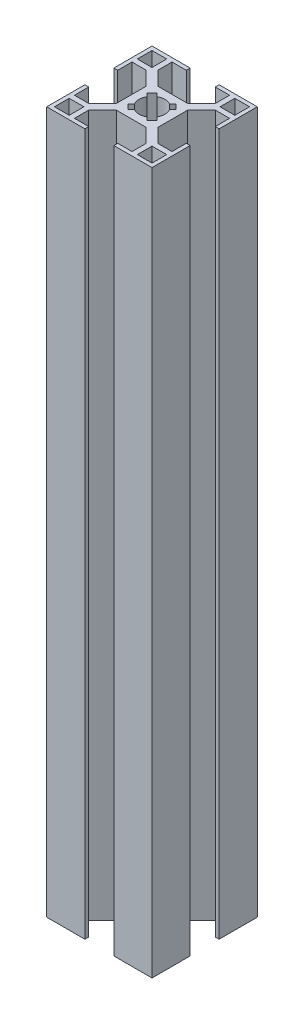
from build123d import *

# Parameters (mm, degrees)
CROQUIS2_W              = 4.2
CROQUIS2_H              = 4.2
SALIENTE_EXTRUIR1_DEPTH = 200


with BuildPart() as part:
    # Croquis2 → Saliente-Extruir1 (new body)
    with BuildSketch(Plane(origin=(0, 0, 0), x_dir=(1, 0, 0), z_dir=(0, 1, 0))):
        Polygon((-37.373217156, 24.271112291), (-26.498217156, 24.271112291), (-26.498217156, 23.171112291), (-30.573217156, 23.171112291), (-30.573217156, 19.168168566), (-26.586160881, 15.181112291), (-18.160273431, 15.181112291), (-14.173217156, 19.168168566), (-14.173217156, 23.171112291), (-18.248217156, 23.171112291), (-18.248217156, 24.271112291), (-7.373217156, 24.271112291), (-7.373217156, 13.396112291), (-8.473217156, 13.396112291), (-8.473217156, 17.471112291), (-12.476160881, 17.471112291), (-16.463217156, 13.484056016), (-16.463217156, 5.058168566), (-12.476160881, 1.071112291), (-8.473217156, 1.071112291), (-8.473217156, 5.146112291), (-7.373217156, 5.146112291), (-7.373217156, -5.728887709), (-18.248217156, -5.728887709), (-18.248217156, -4.628887709), (-14.173217156, -4.628887709), (-14.173217156, -0.625943984), (-18.160273431, 3.361112291), (-26.586160881, 3.361112291), (-30.573217156, -0.625943984), (-30.573217156, -4.628887709), (-26.498217156, -4.628887709), (-26.498217156, -5.728887709), (-37.373217156, -5.728887709), (-37.373217156, 5.146112291), (-36.273217156, 5.146112291), (-36.273217156, 1.071112291), (-32.270273431, 1.071112291), (-28.283217156, 5.058168566), (-28.283217156, 13.484056016), (-32.270273431, 17.471112291), (-36.273217156, 17.471112291), (-36.273217156, 13.396112291), (-37.373217156, 13.396112291), align=None)
        with Locations((-10.573217156, 21.071112291)):
            Rectangle(CROQUIS2_W, CROQUIS2_H, mode=Mode.SUBTRACT)
        with Locations((-34.173217156, -2.528887709)):
            Rectangle(CROQUIS2_W, CROQUIS2_H, mode=Mode.SUBTRACT)
        with Locations((-34.173217156, 21.071112291)):
            Rectangle(CROQUIS2_W, CROQUIS2_H, mode=Mode.SUBTRACT)
        with Locations((-10.573217156, -2.528887709)):
            Rectangle(CROQUIS2_W, CROQUIS2_H, mode=Mode.SUBTRACT)
        with BuildLine():
            Line((-19.165547938, 11.064567946), (-18.248217156, 11.981898728))
            Line((-18.248217156, 11.981898728), (-19.662430718, 13.396112291))
            Line((-19.662430718, 13.396112291), (-20.5797615, 12.478781509))
            ThreePointArc((-20.5797615, 12.478781509), (-22.373217156, 12.946112291), (-24.166672811, 12.478781509))
            Line((-24.166672811, 12.478781509), (-25.084003593, 13.396112291))
            Line((-25.084003593, 13.396112291), (-26.498217156, 11.981898728))
            Line((-26.498217156, 11.981898728), (-25.580886374, 11.064567946))
            ThreePointArc((-25.580886374, 11.064567946), (-26.048217156, 9.271112291), (-25.580886374, 7.477656635))
            Line((-25.580886374, 7.477656635), (-26.498217156, 6.560325853))
            Line((-26.498217156, 6.560325853), (-25.084003593, 5.146112291))
            Line((-25.084003593, 5.146112291), (-24.166672811, 6.063443073))
            ThreePointArc((-24.166672811, 6.063443073), (-22.373217156, 5.596112291), (-20.5797615, 6.063443073))
            Line((-20.5797615, 6.063443073), (-19.662430718, 5.146112291))
            Line((-19.662430718, 5.146112291), (-18.248217156, 6.560325853))
            Line((-18.248217156, 6.560325853), (-19.165547938, 7.477656635))
            ThreePointArc((-19.165547938, 7.477656635), (-18.698217156, 9.271112291), (-19.165547938, 11.064567946))
        make_face(mode=Mode.SUBTRACT)
    extrude(amount=SALIENTE_EXTRUIR1_DEPTH)


solid = part.part
